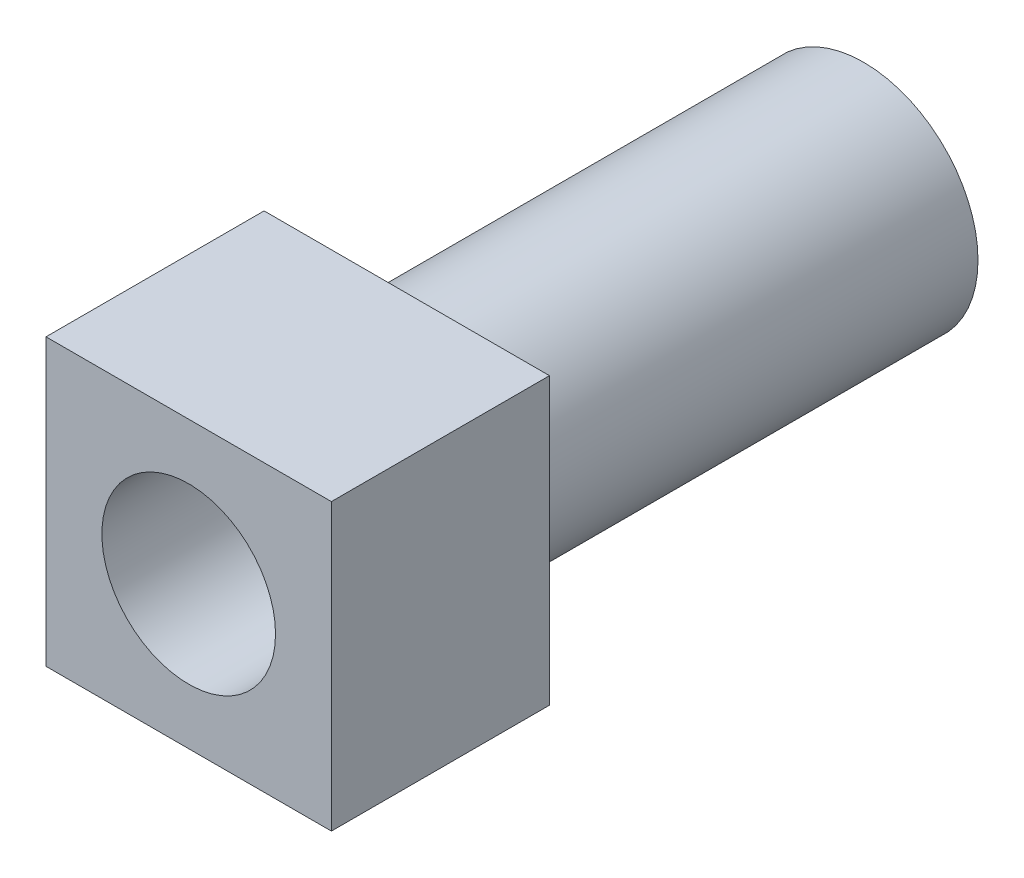
from build123d import *

# Parameters (mm, degrees)
ESQUISSE1_W             = 13.74
ESQUISSE1_H             = 13.74
BOSS_EXTRU_1_DEPTH      = 10.5
ESQUISSE3_R             = 4.18
ENL_V_MAT_EXTRU_2_DEPTH = 10
ESQUISSE2_R             = 2.49
BOSS_EXTRU_4_DEPTH      = 22
ENL_V_START             = -22
ENL_V_MAT_EXTRU_4_DEPTH = 22
ESQUISSE6_R             = 5.5
ESQUISSE6_R_2           = 2.49
BOSS_EXTRU_5_DEPTH      = 22


with BuildPart() as part:
    # Esquisse1 → Boss.-Extru.1 (new body)
    with BuildSketch(Plane.XY):
        with Locations((-30.186071131, 8.6104)):
            Rectangle(ESQUISSE1_W, ESQUISSE1_H)
    extrude(amount=BOSS_EXTRU_1_DEPTH)

    # Esquisse3 → Enlèv. mat.-Extru.2 (cut)
    with BuildSketch(Plane.XY.offset(10.5)):
        with Locations((-30.186071131, 8.6104)):
            Circle(ESQUISSE3_R)
    extrude(amount=-ENL_V_MAT_EXTRU_2_DEPTH, mode=Mode.SUBTRACT)

    # Esquisse2 → Boss.-Extru.4 (add)
    with BuildSketch(Plane(origin=(0, 0, 0), x_dir=(-1, 0, 0), z_dir=(0, 0, -1))):
        with Locations(Location((30.186071131, 8.6104, 0), (0, 0, 180))):
            Circle(ESQUISSE2_R)
    extrude(amount=BOSS_EXTRU_4_DEPTH)

    # Esquisse5 → Enlèv. mat.-Extru.4 (cut)
    with BuildSketch(Plane(origin=(0, 0, -22), x_dir=(-1, 0, 0), z_dir=(0, 0, -1)).offset(ENL_V_START)):
        with BuildLine():
            Line((27.696071131, 8.6104), (29.625790006, 11.036546134))
            ThreePointArc((29.625790006, 11.036546134), (32.134814315, 7.0604), (27.696071131, 8.6104))
        make_face()
    extrude(amount=ENL_V_MAT_EXTRU_4_DEPTH, mode=Mode.SUBTRACT)

    # Esquisse6 → Boss.-Extru.5 (add)
    with BuildSketch(Plane(origin=(0, 0, 0), x_dir=(-1, 0, 0), z_dir=(0, 0, -1))):
        with Locations(Location((30.186071131, 8.6104, 0), (0, 0, 180))):
            Circle(ESQUISSE6_R)
        with Locations((30.186071131, 8.6104)):
            Circle(ESQUISSE6_R_2, mode=Mode.SUBTRACT)
    extrude(amount=BOSS_EXTRU_5_DEPTH)


solid = part.part
